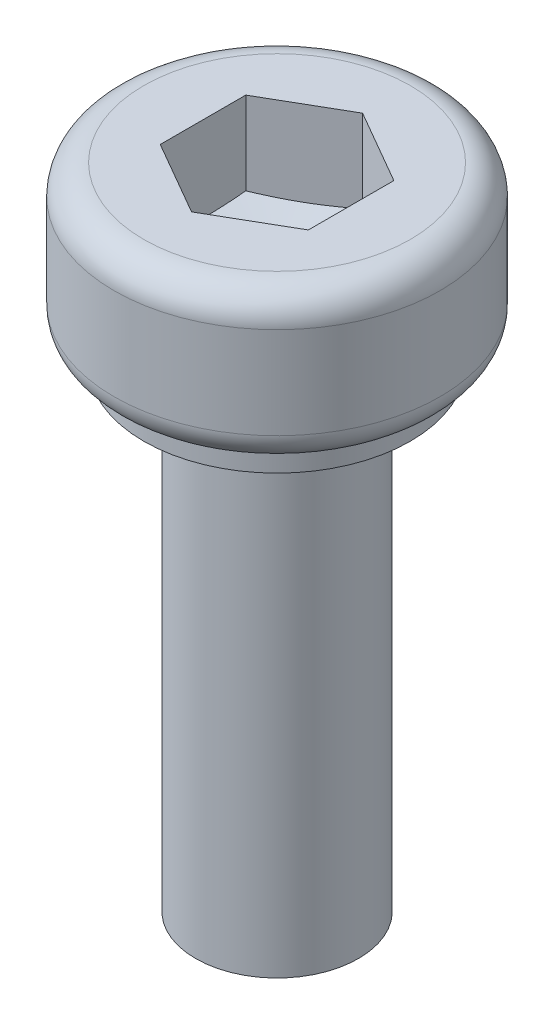
from build123d import *

# Parameters (mm, degrees)
BOSS_EXTRUDE1_DEPTH = 2


with BuildPart() as part:
    # Sketch1 → Revolve1 (revolve)
    with BuildSketch(Plane.XY):
        with BuildLine():
            Line((0, 5.475), (2.25, 5.475))
            ThreePointArc((2.25, 5.475), (2.603553391, 5.328553391), (2.75, 4.975))
            Line((2.75, 4.975), (2.75, 3.425))
            ThreePointArc((2.75, 3.425), (2.603553391, 3.071446609), (2.25, 2.925))
            Line((2.25, 2.925), (2.25, 2.525))
            Line((2.25, 2.525), (1.375, 2.525))
            Line((1.375, 2.525), (1.375, -5.475))
            Line((1.375, -5.475), (0, -5.475))
            Line((0, -5.475), (0, 5.475))
        make_face()
    revolve(axis=Axis((0, 4.094224924, 0), (0, -1, 0)))


with BuildPart() as body_2:
    # Sketch2 → Boss-Extrude1 (new body)
    with BuildSketch(Plane(origin=(0, 5.475, 0), x_dir=(1, 0, 0), z_dir=(0, 1, 0))):
        Polygon((0, 1.443375673), (-1.25, 0.721687836), (-1.25, -0.721687836), (0, -1.443375673), (1.25, -0.721687836), (1.25, 0.721687836), align=None)
    extrude(amount=-BOSS_EXTRUDE1_DEPTH)

    # Sketch3 → Cut-Revolve1 (revolve, cut)
    with BuildSketch(Plane(origin=(0, 0, 0), x_dir=(0, 0, -1), z_dir=(1, 0, 0))):
        Polygon((0, 3.875), (0.4, 3.875), (1.443375673, 4.075), (1.443375673, 3.475), (0, 3.475), align=None)
    revolve(axis=Axis((0, 3.475, 0), (0, 1, 0)), mode=Mode.SUBTRACT)


with BuildPart() as part_1:
    add(part.part)

    # Combine1: cut body 2
    add(body_2.part, mode=Mode.SUBTRACT)


solid = part_1.part
